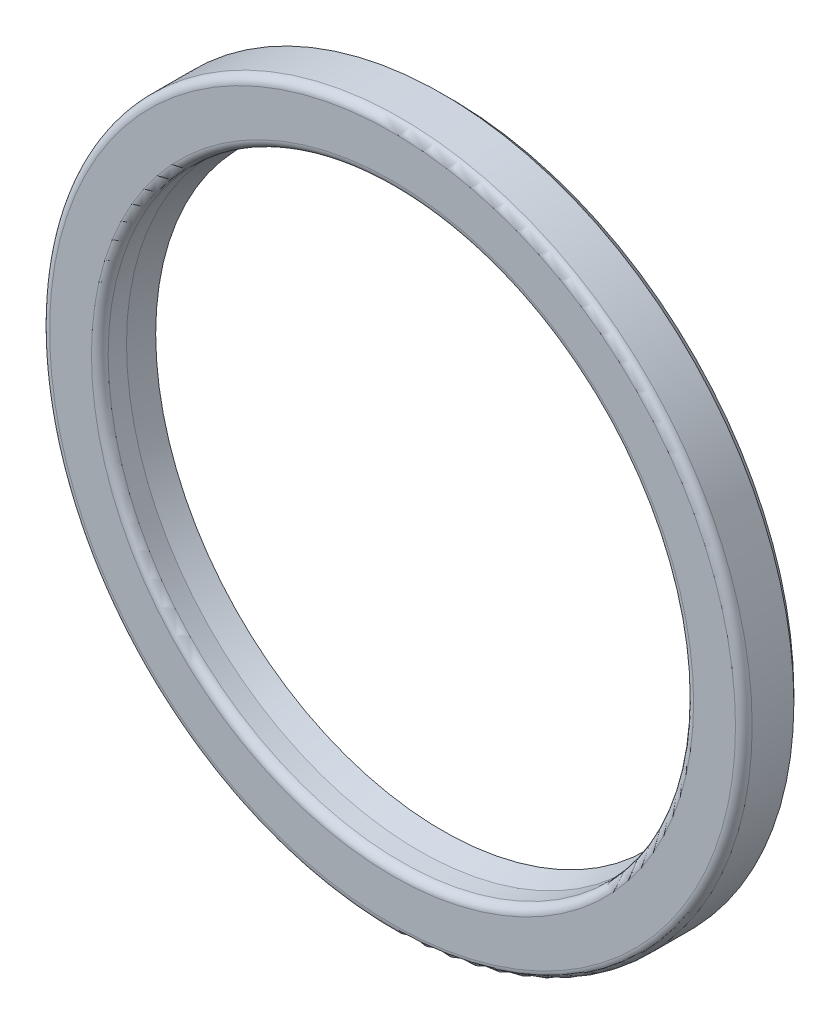
from build123d import *


with BuildPart() as part:
    # Sketch1 → Revolve1 (revolve)
    with BuildSketch(Plane(origin=(0, 0, 0), x_dir=(0, 0, -1), z_dir=(1, 0, 0)), mode=Mode.PRIVATE) as revolve1_sk:
        with BuildLine():
            Line((0, 18.05), (0, 20.56))
            ThreePointArc((0, 20.56), (0.146446609, 20.913553391), (0.5, 21.06))
            Line((0.5, 21.06), (3, 21.06))
            Line((3, 21.06), (3.5, 20.56))
            Line((3.5, 20.56), (3.5, 20.4))
            Line((3.5, 20.4), (0.5, 20.4))
            Line((0.5, 20.4), (0.5, 19.4))
            Line((0.5, 19.4), (3.5, 18.3))
            Line((3.5, 18.3), (3.5, 18))
            Line((3.5, 18), (3, 17.2))
            Line((3, 17.2), (1.6, 17.55))
            Line((1.6, 17.55), (0.5, 17.55))
            ThreePointArc((0.5, 17.55), (0.146446609, 17.696446609), (0, 18.05))
        make_face()
    revolve(revolve1_sk.sketch.rotate(Axis((0, 0, 0), (0, 0, -1)), 90), axis=Axis((0, 0, 0), (0, 0, -1)))


solid = part.part
